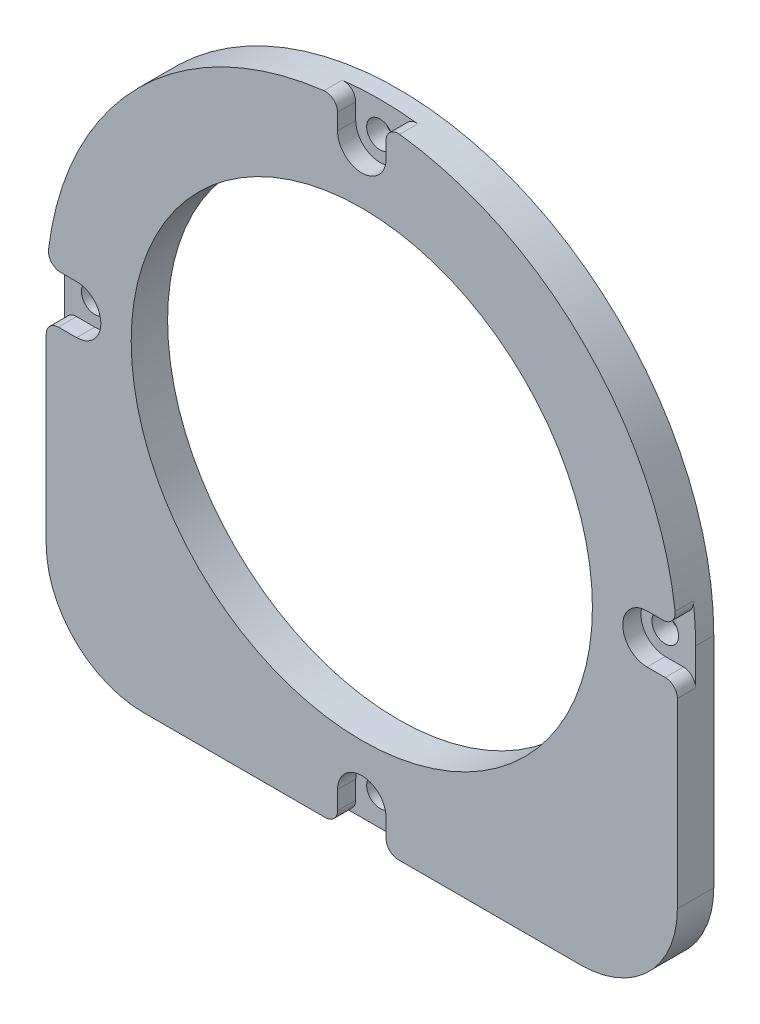
from build123d import *

# Parameters (mm, degrees)
SKETCH_1_R          = 19
EXTRUDE_1_DEPTH     = 3
SKETCH_2_R          = 1.1
CUT_EXTRUDE_1_DEPTH = 37.891733491
CUT_EXTRUDE_2_DEPTH = 1.5
FILLET_1_R          = 1
FILLET_2_R          = 8


with BuildPart() as part:
    # Эскиз1 → Бобышка-Вытянуть1 (new body)
    with BuildSketch(Plane.XY):
        with BuildLine():
            Line((-26, 0), (-26, -26))
            Line((-26, -26), (26, -26))
            Line((26, -26), (26, 0))
            ThreePointArc((26, 0), (0, 26), (-26, 0))
        make_face()
        Circle(SKETCH_1_R, mode=Mode.SUBTRACT)
    extrude(amount=EXTRUDE_1_DEPTH)

    # Эскиз2 → Вырез-Вытянуть1 (cut, through all)
    with BuildSketch(Plane.XY.offset(3)):
        with Locations((0, 23.5)):
            Circle(SKETCH_2_R)
        with Locations((23.5, 0)):
            Circle(SKETCH_2_R)
        with Locations((0, -23.5)):
            Circle(SKETCH_2_R)
        with Locations((-23.5, 0)):
            Circle(SKETCH_2_R)
    extrude(amount=-CUT_EXTRUDE_1_DEPTH, mode=Mode.SUBTRACT)

    # Эскиз3 → Вырез-Вытянуть2 (cut)
    with BuildSketch(Plane.XY.offset(3)):
        with BuildLine():
            Line((-2, 23.5), (-2, 26))
            Line((-2, 26), (2, 26))
            Line((2, 26), (2, 23.5))
            ThreePointArc((2, 23.5), (0, 21.5), (-2, 23.5))
        make_face()
        with BuildLine():
            Line((26, -2), (23.5, -2))
            ThreePointArc((23.5, -2), (21.5, 0), (23.5, 2))
            Line((23.5, 2), (26, 2))
            Line((26, 2), (26, -2))
        make_face()
        with BuildLine():
            Line((-2, -26), (-2, -23.5))
            ThreePointArc((-2, -23.5), (0, -21.5), (2, -23.5))
            Line((2, -23.5), (2, -26))
            Line((2, -26), (-2, -26))
        make_face()
        with BuildLine():
            Line((-26, 2), (-23.5, 2))
            ThreePointArc((-23.5, 2), (-21.5, 0), (-23.5, -2))
            Line((-23.5, -2), (-26, -2))
            Line((-26, -2), (-26, 2))
        make_face()
    extrude(amount=-CUT_EXTRUDE_2_DEPTH, mode=Mode.SUBTRACT)

    # Скругление1
    fillet_1_edges = [part.edges().sort_by_distance(p)[0] for p in [
        (-25.922962794, 2, 2.25),
        (25.922962794, 2, 2.25),
        (2, 25.922962794, 2.25),
        (-2, 25.922962794, 2.25),
        (26, -2, 2.25),
        (2, -26, 2.25),
        (-2, -26, 2.25),
        (-26, -2, 2.25),
    ]]
    fillet(fillet_1_edges, radius=FILLET_1_R)

    # Скругление2
    fillet_2_edges = [part.edges().sort_by_distance(p)[0] for p in [
        (26, -26, 1.5),
        (-26, -26, 1.5),
    ]]
    fillet(fillet_2_edges, radius=FILLET_2_R)


solid = part.part
